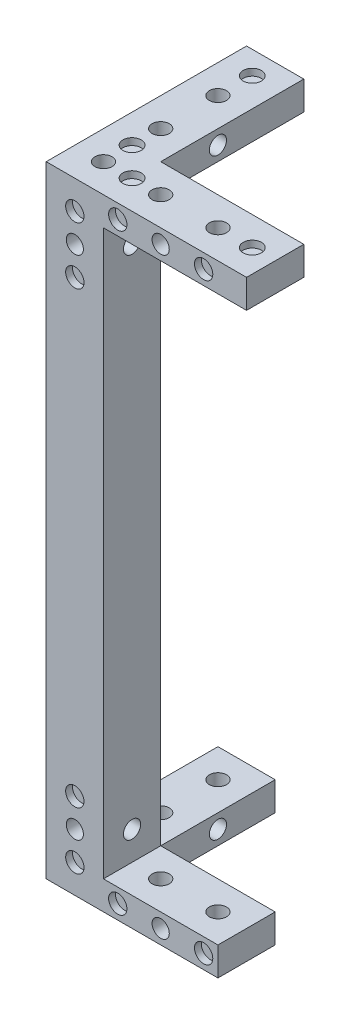
from build123d import *

# Parameters (mm, degrees)
SKETCH1_W           = 10
SKETCH1_H           = 20
SKETCH1_H_2         = 10
SKETCH1_W_2         = 20
BOSS_EXTRUDE1_DEPTH = 10
SKETCH2_W           = 10
SKETCH2_H           = 10
BOSS_EXTRUDE2_DEPTH = 93.5
SKETCH3_W           = 10
SKETCH3_H           = 20
SKETCH3_H_2         = 10
SKETCH3_W_2         = 20
BOSS_EXTRUDE3_DEPTH = 5
SKETCH4_W           = 20
SKETCH4_H           = 10
SKETCH4_W_2         = 10
SKETCH4_H_2         = 20
CUT_EXTRUDE1_DEPTH  = 5
SKETCH5_R           = 1.6
CUT_EXTRUDE2_DEPTH  = 1.2
SKETCH6_R           = 1.5
CUT_EXTRUDE3_DEPTH  = 10
SKETCH7_R           = 1.6
CUT_EXTRUDE4_DEPTH  = 1.2
SKETCH8_R           = 1.5
CUT_EXTRUDE5_DEPTH  = 10.2
SKETCH9_R           = 1.5
CUT_EXTRUDE6_DEPTH  = 10.2
SKETCH10_R          = 1.5
CUT_EXTRUDE7_DEPTH  = 12.2
SKETCH11_R          = 1.5
CUT_EXTRUDE8_DEPTH  = 10
CUT_EXTRUDE9_START  = -12
SKETCH12_R          = 1.5
CUT_EXTRUDE9_DEPTH  = 12
SKETCH13_R          = 1.6
CUT_EXTRUDE10_DEPTH = 1.2
SKETCH14_W          = 10
SKETCH14_H          = 5
BOSS_EXTRUDE4_DEPTH = 5
SKETCH15_W          = 10
SKETCH15_H          = 5
BOSS_EXTRUDE5_DEPTH = 5
SKETCH16_R          = 1.6
CUT_EXTRUDE11_DEPTH = 1.2


with BuildPart() as part:
    # Sketch1 → Boss-Extrude1 (new body)
    with BuildSketch(Plane(origin=(0, 0, 0), x_dir=(1, 0, 0), z_dir=(0, 1, 0))):
        with Locations((5, 20)):
            Rectangle(SKETCH1_W, SKETCH1_H)
        with Locations((5, 5)):
            Rectangle(SKETCH1_W, SKETCH1_H_2)
        with Locations((20, 5)):
            Rectangle(SKETCH1_W_2, SKETCH1_H_2)
    extrude(amount=BOSS_EXTRUDE1_DEPTH)

    # Sketch2 → Boss-Extrude2 (add)
    with BuildSketch(Plane(origin=(0, 10, 0), x_dir=(1, 0, 0), z_dir=(0, 1, 0))):
        with Locations((5, 5)):
            Rectangle(SKETCH2_W, SKETCH2_H)
    extrude(amount=BOSS_EXTRUDE2_DEPTH)

    # Sketch3 → Boss-Extrude3 (add)
    with BuildSketch(Plane(origin=(0, 103.5, 0), x_dir=(1, 0, 0), z_dir=(0, 1, 0))):
        with Locations((5, 20)):
            Rectangle(SKETCH3_W, SKETCH3_H)
        with Locations((5, 5)):
            Rectangle(SKETCH3_W, SKETCH3_H_2)
        with Locations((20, 5)):
            Rectangle(SKETCH3_W_2, SKETCH3_H_2)
    extrude(amount=BOSS_EXTRUDE3_DEPTH)

    # Sketch4 → Cut-Extrude1 (cut)
    with BuildSketch(Plane(origin=(0, 10, 0), x_dir=(1, 0, 0), z_dir=(0, 1, 0))):
        with Locations((20, 5)):
            Rectangle(SKETCH4_W, SKETCH4_H)
        with Locations((5, 20)):
            Rectangle(SKETCH4_W_2, SKETCH4_H_2)
    extrude(amount=-CUT_EXTRUDE1_DEPTH, mode=Mode.SUBTRACT)

    # Sketch5 → Cut-Extrude2 (cut)
    with BuildSketch(Plane.XY):
        with Locations((5, 5)):
            Circle(SKETCH5_R)
        with Locations((27.5, 2.5)):
            Circle(SKETCH5_R)
        with Locations((5, 15)):
            Circle(SKETCH5_R)
        with Locations((12.5, 2.5)):
            Circle(SKETCH5_R)
        with Locations(Location((27.5, 106, 0), (0, 0, 180))):
            Circle(SKETCH5_R)
        with Locations(Location((12.5, 106, 0), (0, 0, 180))):
            Circle(SKETCH5_R)
        with Locations(Location((5, 103.5, 0), (0, 0, 180))):
            Circle(SKETCH5_R)
        with Locations(Location((5, 93.5, 0), (0, 0, 180))):
            Circle(SKETCH5_R)
    extrude(amount=-CUT_EXTRUDE2_DEPTH, mode=Mode.SUBTRACT)

    # Sketch6 → Cut-Extrude3 (cut)
    with BuildSketch(Plane.XY):
        with Locations((20, 106)):
            Circle(SKETCH6_R)
        with Locations((5, 98.5)):
            Circle(SKETCH6_R)
        with Locations((5, 10)):
            Circle(SKETCH6_R)
        with Locations((20, 2.5)):
            Circle(SKETCH6_R)
    extrude(amount=-CUT_EXTRUDE3_DEPTH, mode=Mode.SUBTRACT)

    # Sketch7 → Cut-Extrude4 (cut)
    with BuildSketch(Plane.ZY):
        with Locations((-27.5, 106)):
            Circle(SKETCH7_R)
        with Locations((-12.5, 106)):
            Circle(SKETCH7_R)
        with Locations((-5, 103.5)):
            Circle(SKETCH7_R)
        with Locations((-5, 93.5)):
            Circle(SKETCH7_R)
        with Locations((-27.5, 2.5)):
            Circle(SKETCH7_R)
        with Locations((-12.5, 2.5)):
            Circle(SKETCH7_R)
        with Locations((-5, 5)):
            Circle(SKETCH7_R)
        with Locations((-5, 15)):
            Circle(SKETCH7_R)
    extrude(amount=-CUT_EXTRUDE4_DEPTH, mode=Mode.SUBTRACT)

    # Sketch8 → Cut-Extrude5 (cut)
    with BuildSketch(Plane.ZY):
        with Locations((-20, 106)):
            Circle(SKETCH8_R)
        with Locations((-5, 98.5)):
            Circle(SKETCH8_R)
        with Locations(Location((-5, 10, 0), (0, 0, 270))):
            Circle(SKETCH8_R)
        with Locations((-20, 2.5)):
            Circle(SKETCH8_R)
    extrude(amount=-CUT_EXTRUDE5_DEPTH, mode=Mode.SUBTRACT)

    # Sketch9 → Cut-Extrude6 (cut)
    with BuildSketch(Plane(origin=(0, 5, 0), x_dir=(1, 0, 0), z_dir=(0, 1, 0))):
        with Locations(Location((25, 5, 0), (0, 0, 270))):
            Circle(SKETCH9_R)
        with Locations(Location((15, 5, 0), (0, 0, 270))):
            Circle(SKETCH9_R)
        with Locations(Location((5, 15, 0), (0, 0, 270))):
            Circle(SKETCH9_R)
        with Locations(Location((5, 25, 0), (0, 0, 270))):
            Circle(SKETCH9_R)
    extrude(amount=-CUT_EXTRUDE6_DEPTH, mode=Mode.SUBTRACT)

    # Sketch10 → Cut-Extrude7 (cut)
    with BuildSketch(Plane.XZ):
        with Locations(Location((5, -5, 0), (0, 0, 270))):
            Circle(SKETCH10_R)
    extrude(amount=-CUT_EXTRUDE7_DEPTH, mode=Mode.SUBTRACT)

    # Sketch11 → Cut-Extrude8 (cut)
    with BuildSketch(Plane(origin=(0, 108.5, 0), x_dir=(1, 0, 0), z_dir=(0, 1, 0))):
        with Locations(Location((5, 15, 0), (0, 0, 270))):
            Circle(SKETCH11_R)
        with Locations(Location((5, 25, 0), (0, 0, 270))):
            Circle(SKETCH11_R)
        with Locations(Location((15, 5, 0), (0, 0, 270))):
            Circle(SKETCH11_R)
        with Locations(Location((25, 5, 0), (0, 0, 270))):
            Circle(SKETCH11_R)
    extrude(amount=-CUT_EXTRUDE8_DEPTH, mode=Mode.SUBTRACT)

    # Sketch12 → Cut-Extrude9 (cut)
    with BuildSketch(Plane(origin=(0, 108.5, 0), x_dir=(1, 0, 0), z_dir=(0, 1, 0)).offset(CUT_EXTRUDE9_START)):
        with Locations(Location((5, 5, 0), (0, 0, 90))):
            Circle(SKETCH12_R)
    extrude(amount=CUT_EXTRUDE9_DEPTH, mode=Mode.SUBTRACT)

    # Sketch13 → Cut-Extrude10 (cut)
    with BuildSketch(Plane(origin=(0, 108.5, 0), x_dir=(1, 0, 0), z_dir=(0, 1, 0))):
        with Locations(Location((10, 5, 0), (0, 0, 270))):
            Circle(SKETCH13_R)
        with Locations(Location((5, 10, 0), (0, 0, 270))):
            Circle(SKETCH13_R)
    extrude(amount=-CUT_EXTRUDE10_DEPTH, mode=Mode.SUBTRACT)

    # Sketch14 → Boss-Extrude4 (add)
    with BuildSketch(Plane(origin=(0, 0, -30), x_dir=(-1, 0, 0), z_dir=(0, 0, -1))):
        with Locations((-5, 106)):
            Rectangle(SKETCH14_W, SKETCH14_H)
    extrude(amount=BOSS_EXTRUDE4_DEPTH)

    # Sketch15 → Boss-Extrude5 (add)
    with BuildSketch(Plane(origin=(30, 0, 0), x_dir=(0, 0, -1), z_dir=(1, 0, 0))):
        with Locations((5, 106)):
            Rectangle(SKETCH15_W, SKETCH15_H)
    extrude(amount=BOSS_EXTRUDE5_DEPTH)

    # Sketch16 → Cut-Extrude11 (cut)
    with BuildSketch(Plane(origin=(0, 108.5, 0), x_dir=(1, 0, 0), z_dir=(0, 1, 0))):
        with Locations(Location((31, 5, 0), (0, 0, 270))):
            Circle(SKETCH16_R)
        with Locations(Location((5, 31, 0), (0, 0, 270))):
            Circle(SKETCH16_R)
    extrude(amount=-CUT_EXTRUDE11_DEPTH, mode=Mode.SUBTRACT)


solid = part.part
